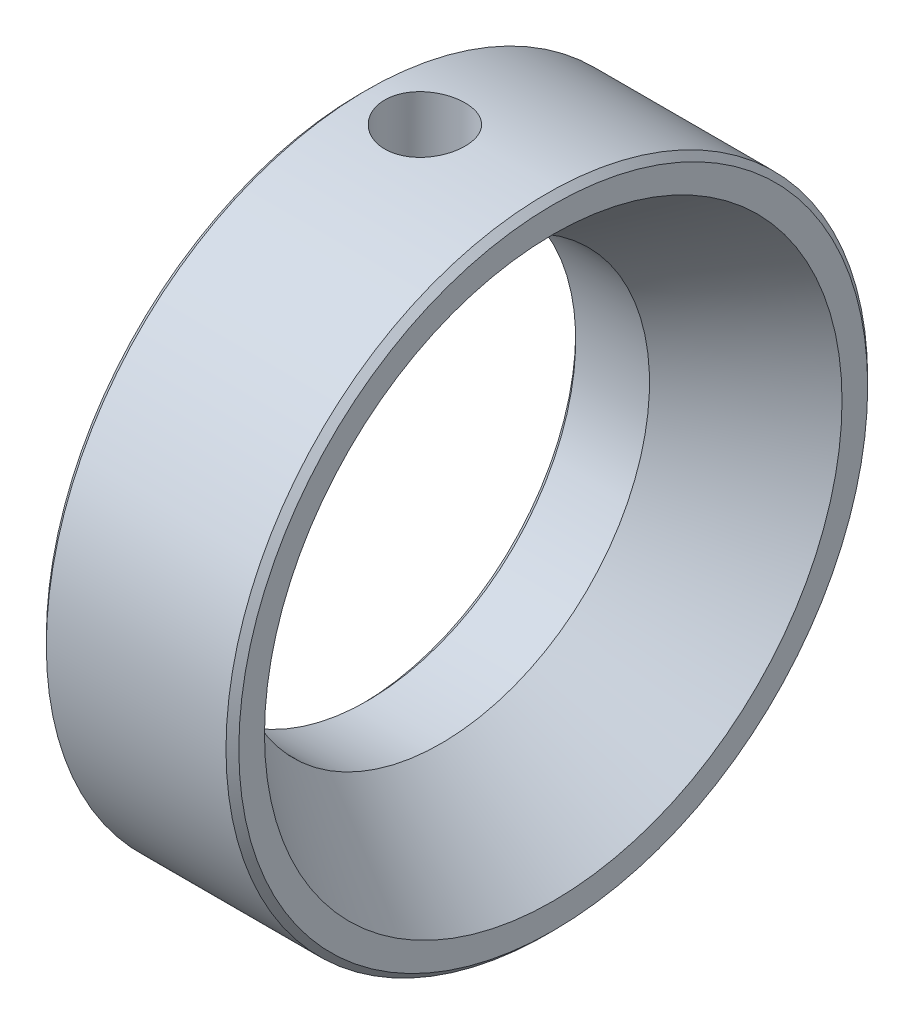
from build123d import *

# Parameters (mm, degrees)
CHAMFER_1_SIZE = 2
SKETCH_2_W     = 12.5
SKETCH_2_H     = 20


with BuildPart() as part:
    # Эскиз1 → Повернуть1 (revolve)
    with BuildSketch(Plane.XY, mode=Mode.PRIVATE) as revolve_1_sk:
        Polygon((-37.682926829, -65), (-37.682926829, -100), (22.317073171, -100), (22.317073171, -90), (-12.682926829, -65), align=None)
    revolve(revolve_1_sk.sketch.rotate(Axis((-193.536585366, 0, 0), (1, 0, 0)), 270), axis=Axis((-193.536585366, 0, 0), (1, 0, 0)))

    # Фаска1
    chamfer_1_edges = [part.edges().sort_by_distance(p)[0] for p in [
        (22.317073171, 0, -100),
        (-37.682926829, 0, -100),
        (-37.682926829, 0, -65),
    ]]
    chamfer(chamfer_1_edges, length=CHAMFER_1_SIZE)

    # Эскиз2 → Вырез-Повернуть1 (revolve, cut)
    with BuildSketch(Plane.XY, mode=Mode.PRIVATE) as cut_revolve_1_sk:
        Polygon((-5.182926829, -99.902279859), (-5.182926829, -79.902279859), (-17.682926829, -79.902279859), (-17.682926829, -99.902279859), (-17.682926829, -106.132104806), (-5.182926829, -106.132104806), align=None)
        with Locations((-11.432926829, 90)):
            Rectangle(SKETCH_2_W, SKETCH_2_H)
    revolve(cut_revolve_1_sk.sketch.rotate(Axis((-17.682926829, 126.68088459, 0), (0, -1, 0)), 180), axis=Axis((-17.682926829, 126.68088459, 0), (0, -1, 0)), mode=Mode.SUBTRACT)


solid = part.part
